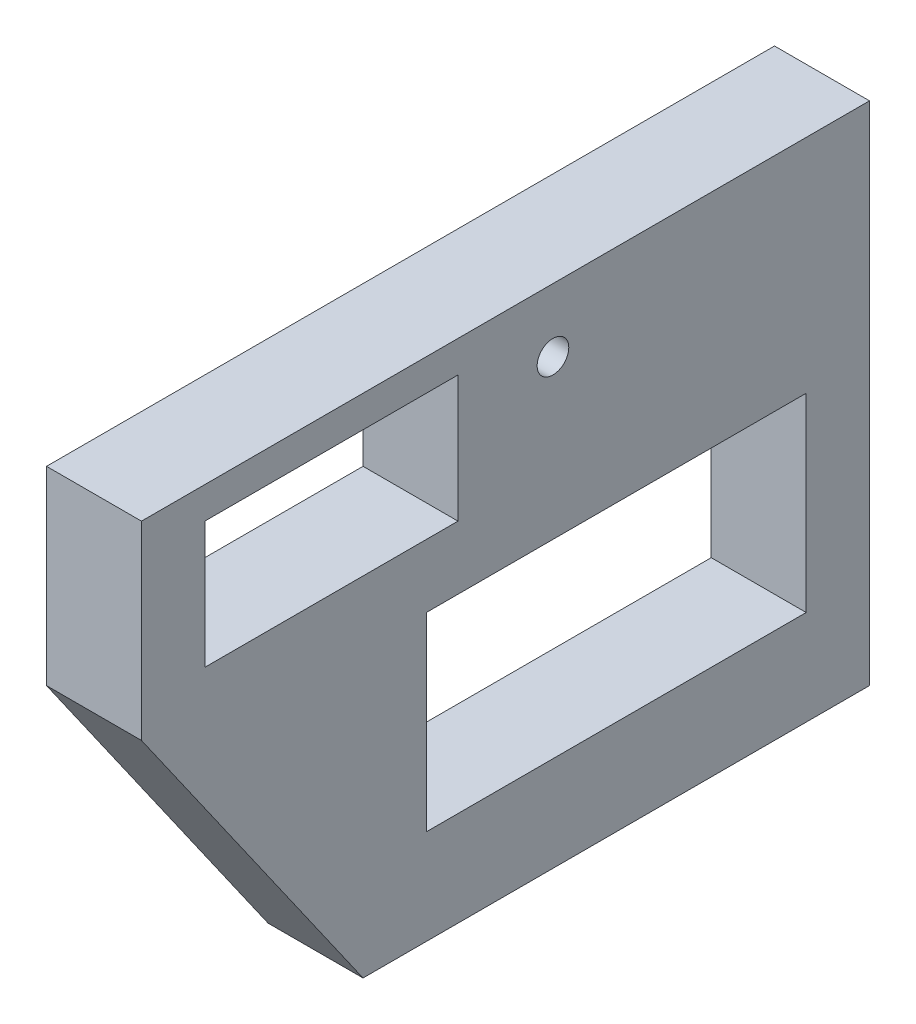
from build123d import *

# Parameters (mm, degrees)
SKETCH1_W           = 40
SKETCH1_H           = 20
SKETCH1_W_2         = 60
SKETCH1_H_2         = 30
BOSS_EXTRUDE1_DEPTH = 15
SKETCH2_R           = 2.5
CUT_EXTRUDE1_DEPTH  = 15


with BuildPart() as part:
    # Sketch1 → Boss-Extrude1 (new body)
    with BuildSketch(Plane(origin=(0, 0, 0), x_dir=(0, 0, -1), z_dir=(1, 0, 0))):
        Polygon((-115, 50), (-80, 0), (0, 0), (0, 80), (-115, 80), align=None)
        with Locations((-85, 65)):
            Rectangle(SKETCH1_W, SKETCH1_H, mode=Mode.SUBTRACT)
        with Locations((-40, 30)):
            Rectangle(SKETCH1_W_2, SKETCH1_H_2, mode=Mode.SUBTRACT)
    extrude(amount=BOSS_EXTRUDE1_DEPTH)

    # Sketch2 → Cut-Extrude1 (cut)
    with BuildSketch(Plane(origin=(15, 0, 0), x_dir=(0, 0, -1), z_dir=(1, 0, 0))):
        with Locations((-50, 70)):
            Circle(SKETCH2_R)
    extrude(amount=-CUT_EXTRUDE1_DEPTH, mode=Mode.SUBTRACT)


solid = part.part
